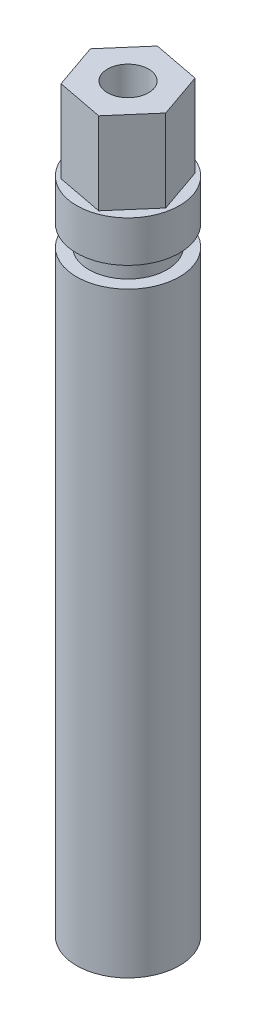
from build123d import *

# Parameters (mm, degrees)
SKETCH1_R           = 15.875
SKETCH1_R_2         = 6.35
BOSS_EXTRUDE1_DEPTH = 215.9
BOSS_EXTRUDE2_START = 12.7
SKETCH2_R           = 15.875
SKETCH2_R_2         = 12.7
BOSS_EXTRUDE2_DEPTH = 12.7
SKETCH3_W           = 3.81
SKETCH3_H           = 6.35
CUT_EXTRUDE1_START  = -25.4
SKETCH4_R           = 15.875
CUT_EXTRUDE1_DEPTH  = 25.4


with BuildPart() as part:
    # Sketch1 → Boss-Extrude1 (new body)
    with BuildSketch(Plane(origin=(0, 0, 0), x_dir=(1, 0, 0), z_dir=(0, 1, 0))):
        with Locations(Location((0, 0, 0), (0, 0, 270))):
            Circle(SKETCH1_R)
        with Locations(Location((0, 0, 0), (0, 0, 270))):
            Circle(SKETCH1_R_2, mode=Mode.SUBTRACT)
    extrude(amount=BOSS_EXTRUDE1_DEPTH)

    # Sketch2 → Boss-Extrude2 (add)
    with BuildSketch(Plane.XZ.offset(BOSS_EXTRUDE2_START)):
        with Locations(Location((0, 0, 0), (0, 0, 270))):
            Circle(SKETCH2_R)
        with Locations(Location((0, 0, 0), (0, 0, 270))):
            Circle(SKETCH2_R_2, mode=Mode.SUBTRACT)
    extrude(amount=-BOSS_EXTRUDE2_DEPTH)

    # Sketch3 → Cut-Revolve1 (revolve, cut)
    with BuildSketch(Plane(origin=(0, 0, 0), x_dir=(0, 0, -1), z_dir=(1, 0, 0))):
        with Locations((13.97, 174.625)):
            Rectangle(SKETCH3_W, SKETCH3_H)
    revolve(axis=Axis((0, -12.7, 0), (0, 1, 0)), mode=Mode.SUBTRACT)

    # Sketch4 → Cut-Extrude1 (cut)
    with BuildSketch(Plane(origin=(0, 215.9, 0), x_dir=(1, 0, 0), z_dir=(0, 1, 0)).offset(CUT_EXTRUDE1_START)):
        with Locations(Location((0, 0, 0), (0, 0, 90))):
            Circle(SKETCH4_R)
        Polygon((9.592403624, 11.092300304), (-4.810012038, 13.853415374), (-14.402415662, 2.76111507), (-9.592403624, -11.092300304), (4.810012038, -13.853415374), (14.402415662, -2.76111507), align=None, mode=Mode.SUBTRACT)
    extrude(amount=CUT_EXTRUDE1_DEPTH, mode=Mode.SUBTRACT)


solid = part.part
